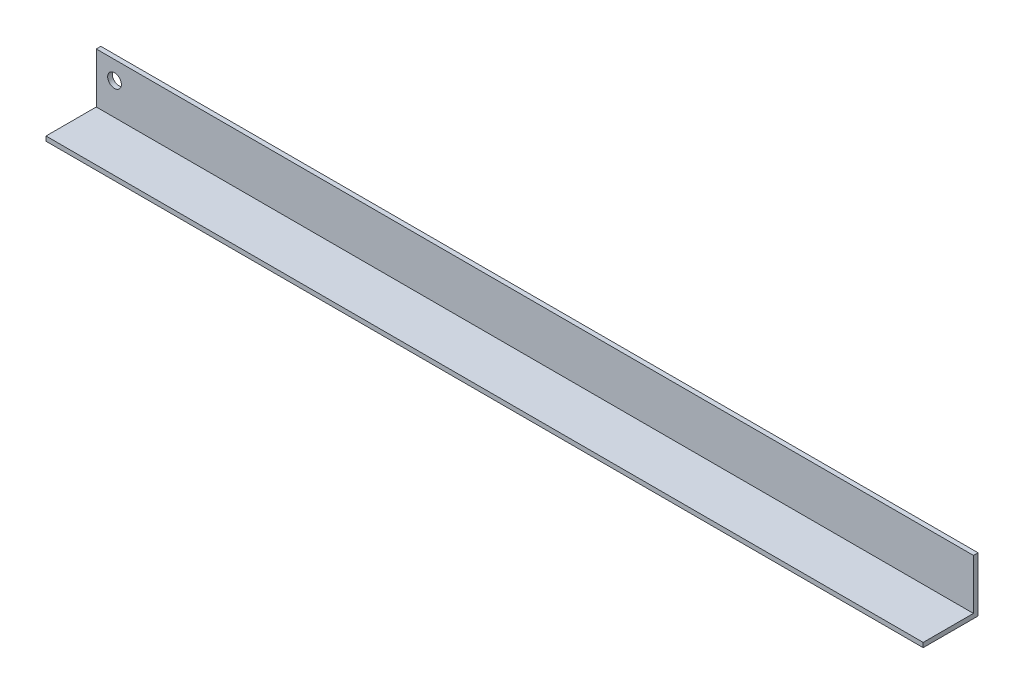
from build123d import *

# Parameters (mm, degrees)
EXTRUDE_THIN1_DEPTH = 304.8
CUT_EXTRUDE1_REACH  = 311.526
SKETCH2_R           = 4.7625


with BuildPart() as part:
    # Sketch1 → Extrude-Thin1 (new, symmetric)
    with BuildSketch(Plane(origin=(0, 0, 0), x_dir=(0, 0, -1), z_dir=(1, 0, 0))):
        Polygon((-38.1, 0), (0, 0), (0, 38.1), (-3.175, 38.1), (-3.175, 3.175), (-38.1, 3.175), align=None)
    extrude(amount=EXTRUDE_THIN1_DEPTH, both=True)

    # Sketch2 → Cut-Extrude1 (cut, up to next)
    with BuildSketch(Plane(origin=(0, 0, 0), x_dir=(-1, 0, 0), z_dir=(0, 0, -1)), mode=Mode.PRIVATE) as cut_extrude1_sk1:
        with Locations((292.1, 25.4)):
            Circle(SKETCH2_R)
    cut_extrude1_tool1 = extrude(cut_extrude1_sk1.sketch, amount=-CUT_EXTRUDE1_REACH, mode=Mode.PRIVATE) & part.part
    add(cut_extrude1_tool1.solids().sort_by_distance((-292.1, 25.4, 0))[0], mode=Mode.SUBTRACT)


solid = part.part
